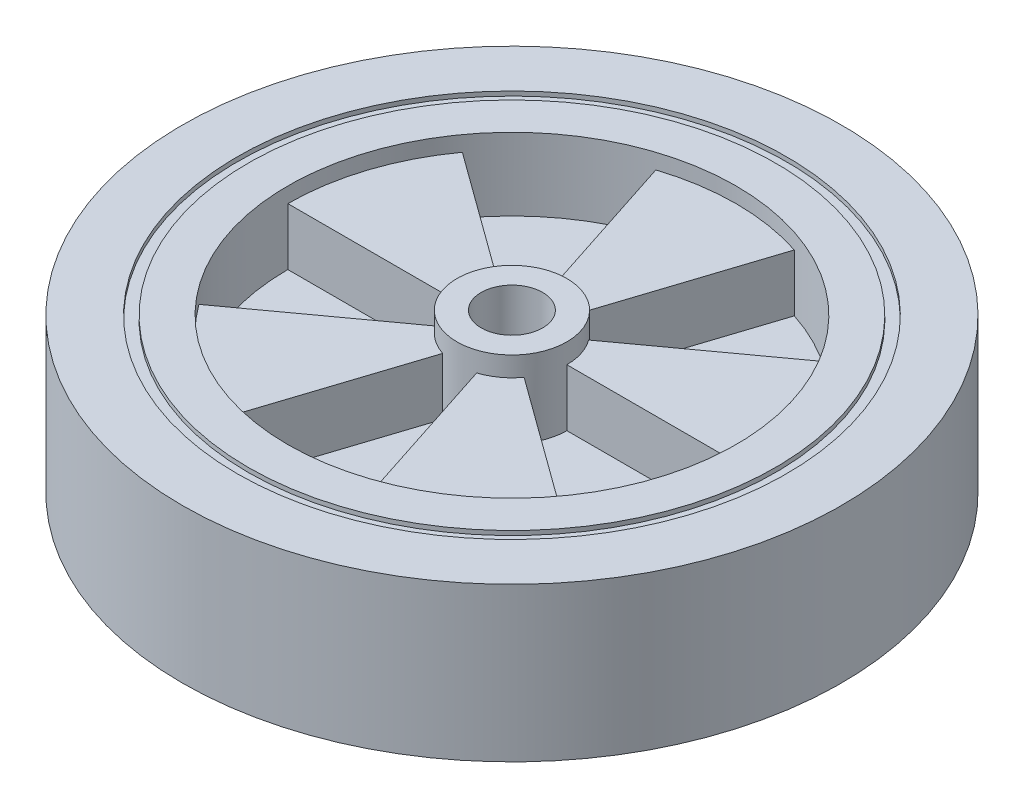
from build123d import *

# Parameters (mm, degrees)
SKETCH1_R           = 75
SKETCH1_R_2         = 51
BOSS_EXTRUDE1_DEPTH = 17.5
SKETCH2_R           = 12.5
SKETCH2_R_2         = 7
BOSS_EXTRUDE2_DEPTH = 18.5
BOSS_EXTRUDE3_DEPTH = 14
SKETCH6_R           = 51
BOSS_EXTRUDE6_DEPTH = 1
SKETCH7_R           = 62.5
SKETCH7_R_2         = 60
CUT_EXTRUDE1_DEPTH  = 1


with BuildPart() as part:
    # Sketch1 → Boss-Extrude1 (new, symmetric)
    with BuildSketch(Plane(origin=(0, 0, 0), x_dir=(1, 0, 0), z_dir=(0, 1, 0))):
        with Locations(Location((0, 0, 0), (0, 0, 270))):
            Circle(SKETCH1_R)
        with Locations(Location((0, 0, 0), (0, 0, 270))):
            Circle(SKETCH1_R_2, mode=Mode.SUBTRACT)
    extrude(amount=BOSS_EXTRUDE1_DEPTH, both=True)



with BuildPart() as body_2:
    # Sketch2 → Boss-Extrude2 (new, symmetric)
    with BuildSketch(Plane(origin=(0, 0, 0), x_dir=(1, 0, 0), z_dir=(0, 1, 0))):
        with Locations(Location((0, 0, 0), (0, 0, 270))):
            Circle(SKETCH2_R)
        with Locations(Location((0, 0, 0), (0, 0, 270))):
            Circle(SKETCH2_R_2, mode=Mode.SUBTRACT)
    extrude(amount=BOSS_EXTRUDE2_DEPTH, both=True)


with BuildPart() as part_1:
    add(part.part)

    add(body_2.part)  # Boss-Extrude3 merges body 2
    # Sketch3 → Boss-Extrude3 (add, symmetric)
    with BuildSketch(Plane(origin=(0, 0, 0), x_dir=(1, 0, 0), z_dir=(0, 1, 0))):
        with BuildLine():
            ThreePointArc((-12.5, 0), (-11.888206454, 3.86271243), (-10.11271243, 7.347315654))
            Line((-10.11271243, 7.347315654), (-41.259866713, 29.977047867))
            ThreePointArc((-41.259866713, 29.977047867), (-48.503882331, 15.759866713), (-51, 0))
            Line((-51, 0), (-12.5, 0))
        make_face()
        with BuildLine():
            ThreePointArc((-3.86271243, 11.888206454), (0, 12.5), (3.86271243, 11.888206454))
            Line((3.86271243, 11.888206454), (15.759866713, 48.503882331))
            ThreePointArc((15.759866713, 48.503882331), (0, 51), (-15.759866713, 48.503882331))
            Line((-15.759866713, 48.503882331), (-3.86271243, 11.888206454))
        make_face()
        with BuildLine():
            Line((41.259866713, 29.977047867), (10.11271243, 7.347315654))
            ThreePointArc((10.11271243, 7.347315654), (11.888206454, 3.86271243), (12.5, 0))
            Line((12.5, 0), (51, 0))
            ThreePointArc((51, 0), (48.503882331, 15.759866713), (41.259866713, 29.977047867))
        make_face()
        with BuildLine():
            Line((41.259866713, -29.977047867), (10.11271243, -7.347315654))
            ThreePointArc((10.11271243, -7.347315654), (7.347315654, -10.11271243), (3.86271243, -11.888206454))
            Line((3.86271243, -11.888206454), (15.759866713, -48.503882331))
            ThreePointArc((15.759866713, -48.503882331), (29.977047867, -41.259866713), (41.259866713, -29.977047867))
        make_face()
        with BuildLine():
            ThreePointArc((-3.86271243, -11.888206454), (-7.347315654, -10.11271243), (-10.11271243, -7.347315654))
            Line((-10.11271243, -7.347315654), (-41.259866713, -29.977047867))
            ThreePointArc((-41.259866713, -29.977047867), (-29.977047867, -41.259866713), (-15.759866713, -48.503882331))
            Line((-15.759866713, -48.503882331), (-3.86271243, -11.888206454))
        make_face()
    extrude(amount=BOSS_EXTRUDE3_DEPTH, both=True)

    # Sketch6 → Boss-Extrude6 (add, symmetric)
    with BuildSketch(Plane(origin=(0, 0, 0), x_dir=(1, 0, 0), z_dir=(0, 1, 0))):
        with Locations(Location((0, 0, 0), (0, 0, 72))):
            Circle(SKETCH6_R)
    extrude(amount=BOSS_EXTRUDE6_DEPTH, both=True)

    # Sketch7 → Cut-Extrude1 (cut)
    with BuildSketch(Plane(origin=(0, 17.5, 0), x_dir=(1, 0, 0), z_dir=(0, 1, 0))):
        with Locations(Location((0, 0, 0), (0, 0, 270))):
            Circle(SKETCH7_R)
        with Locations(Location((0, 0, 0), (0, 0, 270))):
            Circle(SKETCH7_R_2, mode=Mode.SUBTRACT)
    cut_extrude1 = extrude(amount=-CUT_EXTRUDE1_DEPTH, mode=Mode.SUBTRACT)

    # Mirror2: Cut-Extrude1 across plane
    add(cut_extrude1.mirror(Plane.ZX), mode=Mode.SUBTRACT)


solid = part_1.part
